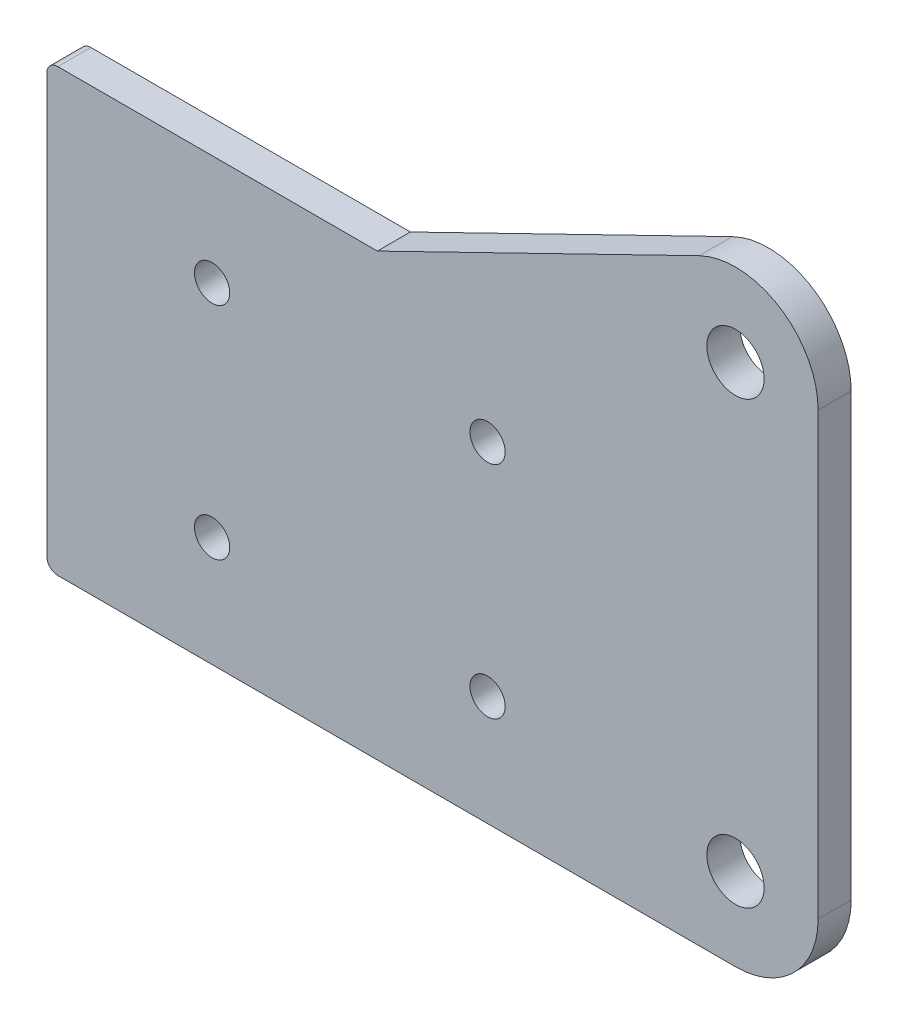
from build123d import *

# Parameters (mm, degrees)
SKETCH_1_R          = 2.6
EXTRUDE_1_DEPTH     = 3
CUT_EXTRUDE_START   = -3
CUT_EXTRUDE_1_DEPTH = 3
SKETCH_3_R          = 1.6
CUT_EXTRUDE_2_DEPTH = 3
FILLET_1_R          = 1


with BuildPart() as part:
    # 草图1 → 凸台-拉伸1 (new body)
    with BuildSketch(Plane.XY):
        with BuildLine():
            Line((-35, -27.5), (27.5, -27.5))
            ThreePointArc((27.5, -27.5), (32.803300859, -25.303300859), (35, -20))
            Line((35, -20), (35, 20))
            ThreePointArc((35, 20), (32.803300859, 25.303300859), (27.5, 27.5))
            Line((27.5, 27.5), (-35, 27.5))
            Line((-35, 27.5), (-35, -27.5))
        make_face()
        with Locations((27.5, 20)):
            Circle(SKETCH_1_R, mode=Mode.SUBTRACT)
        with Locations(Location((27.5, -20, 0), (0, 0, 180))):
            Circle(SKETCH_1_R, mode=Mode.SUBTRACT)
    extrude(amount=EXTRUDE_1_DEPTH)

    # 草图2 → 切除-拉伸1 (cut)
    with BuildSketch(Plane.XY.offset(3).offset(CUT_EXTRUDE_START)):
        with BuildLine():
            Line((-35, 12.5), (-5, 12.5))
            Line((-5, 12.5), (24.213483146, 26.741573034))
            ThreePointArc((24.213483146, 26.741573034), (25.8135537, 27.307933968), (27.5, 27.5))
            Line((27.5, 27.5), (27.5, 37.5))
            Line((27.5, 37.5), (-35, 37.5))
            Line((-35, 37.5), (-35, 12.5))
        make_face()
    extrude(amount=CUT_EXTRUDE_1_DEPTH, mode=Mode.SUBTRACT)

    # 草图3 → 切除-拉伸2 (cut)
    with BuildSketch(Plane.XY.offset(3)):
        with Locations((-20, 2.5)):
            Circle(SKETCH_3_R)
        with Locations(Location((5, 2.5, 0), (0, 0, 180))):
            Circle(SKETCH_3_R)
        with Locations((5, -17.5)):
            Circle(SKETCH_3_R)
        with Locations(Location((-20, -17.5, 0), (0, 0, 180))):
            Circle(SKETCH_3_R)
    extrude(amount=-CUT_EXTRUDE_2_DEPTH, mode=Mode.SUBTRACT)

    # 圆角1
    fillet_1_edges = [part.edges().sort_by_distance(p)[0] for p in [
        (-35, -27.5, 1.5),
        (-35, 12.5, 1.5),
    ]]
    fillet(fillet_1_edges, radius=FILLET_1_R)


solid = part.part
